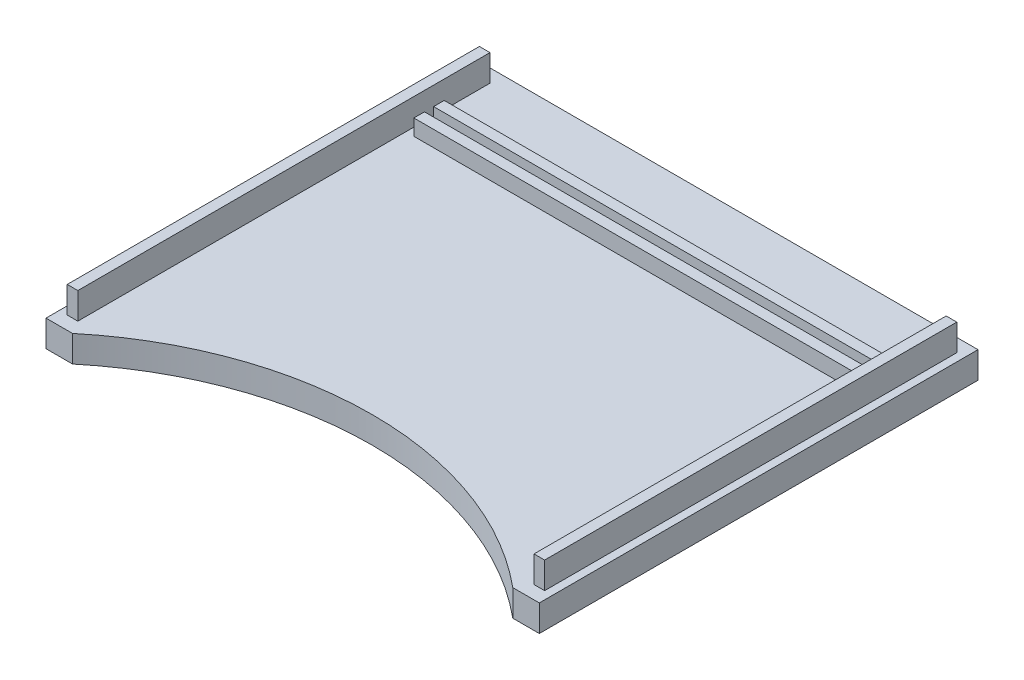
from build123d import *

# Parameters (mm, degrees)
SKETCH1_W           = 186
SKETCH1_H           = 165.4
BOSS_EXTRUDE1_DEPTH = 10
CUT_EXTRUDE5_DEPTH  = 250.104716936
SKETCH4_W           = 166
SKETCH4_H           = 4
BOSS_EXTRUDE3_DEPTH = 6
SKETCH6_W           = 4
SKETCH6_H           = 155.4
BOSS_EXTRUDE4_DEPTH = 10
SKETCH7_W           = 4
SKETCH7_H           = 155.4
BOSS_EXTRUDE5_DEPTH = 10


with BuildPart() as part:
    # Sketch1 → Boss-Extrude1 (new body)
    with BuildSketch(Plane(origin=(0, 0, 0), x_dir=(1, 0, 0), z_dir=(0, 1, 0))):
        with Locations((93, 82.7)):
            Rectangle(SKETCH1_W, SKETCH1_H)
    extrude(amount=BOSS_EXTRUDE1_DEPTH)

    # Sketch5 → Cut-Extrude5 (cut, through all)
    with BuildSketch(Plane(origin=(0, 10, 0), x_dir=(1, 0, 0), z_dir=(0, 1, 0))):
        with BuildLine():
            Line((176, 0), (10, 0))
            ThreePointArc((10, 0), (93, 30), (176, 0))
        make_face()
    extrude(amount=-CUT_EXTRUDE5_DEPTH, mode=Mode.SUBTRACT)

    # Sketch4 → Boss-Extrude3 (add)
    with BuildSketch(Plane(origin=(0, 10, 0), x_dir=(1, 0, 0), z_dir=(0, 1, 0))):
        with Locations((93, 130.7)):
            Rectangle(SKETCH4_W, SKETCH4_H)
        with Locations((93, 138.14)):
            Rectangle(SKETCH4_W, SKETCH4_H)
    extrude(amount=BOSS_EXTRUDE3_DEPTH)

    # Sketch6 → Boss-Extrude4 (add)
    with BuildSketch(Plane(origin=(0, 10, 0), x_dir=(1, 0, 0), z_dir=(0, 1, 0))):
        with Locations((181, 82.7)):
            Rectangle(SKETCH6_W, SKETCH6_H)
    extrude(amount=BOSS_EXTRUDE4_DEPTH)

    # Sketch7 → Boss-Extrude5 (add)
    with BuildSketch(Plane(origin=(0, 10, 0), x_dir=(1, 0, 0), z_dir=(0, 1, 0))):
        with Locations((5, 82.7)):
            Rectangle(SKETCH7_W, SKETCH7_H)
    extrude(amount=BOSS_EXTRUDE5_DEPTH)


solid = part.part
